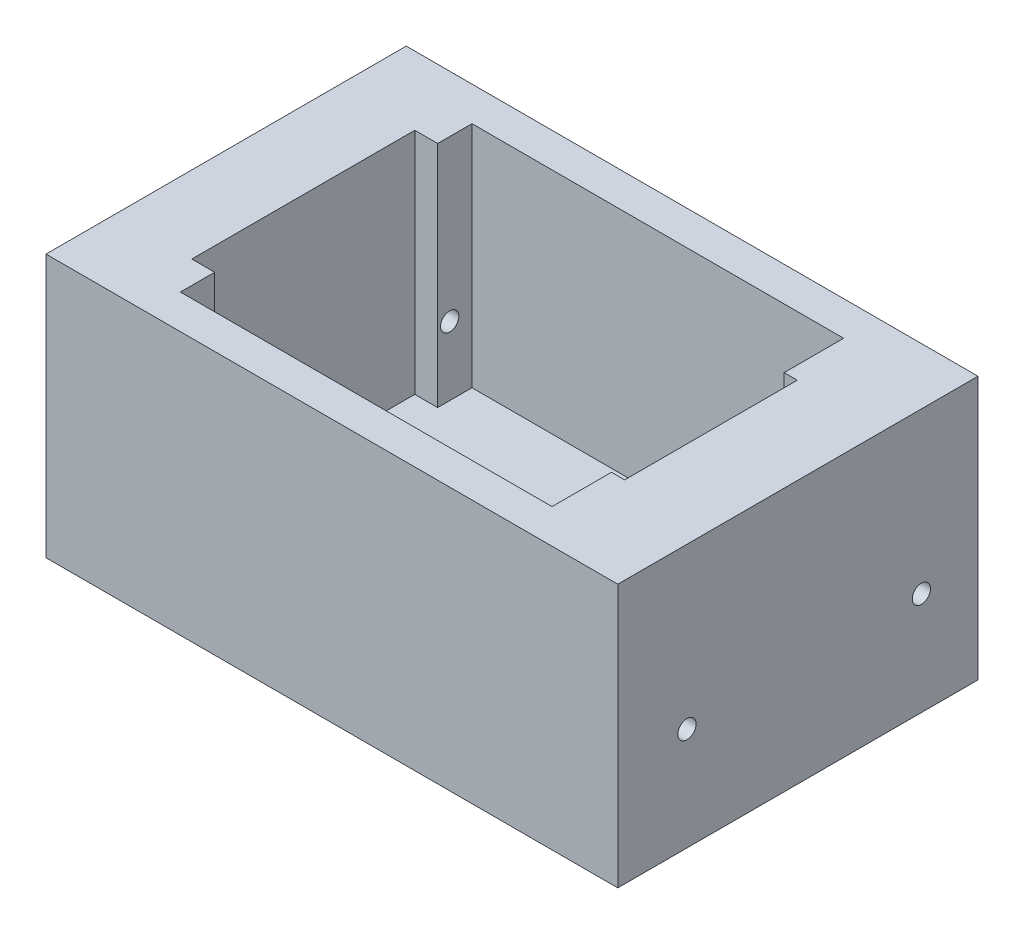
from build123d import *

# Parameters (mm, degrees)
SKETCH1_W               = 50
SKETCH1_H               = 31.5
BOSS_EXTRUDE1_DEPTH     = 23
CUT_EXTRUDE1_DEPTH      = 20
CUT_EXTRUDE2_DEPTH      = 57.769820327
CUT_EXTRUDE2_DEPTH_BACK = 57.769820327
SKETCH3_R               = 0.8


with BuildPart() as part:
    # Sketch1 → Boss-Extrude1 (new body)
    with BuildSketch(Plane(origin=(0, 0, 0), x_dir=(1, 0, 0), z_dir=(0, 1, 0))):
        with Locations((25, 15.75)):
            Rectangle(SKETCH1_W, SKETCH1_H)
    extrude(amount=BOSS_EXTRUDE1_DEPTH)

    # Sketch2 → Cut-Extrude1 (cut)
    with BuildSketch(Plane(origin=(0, 23, 0), x_dir=(1, 0, 0), z_dir=(0, 1, 0))):
        Polygon((41.25, 28.5), (8.75, 28.5), (8.75, 25.5), (6.75, 25.5), (6.75, 6), (8.75, 6), (8.75, 3), (41.25, 3), (41.25, 8.2), (42.4, 8.2), (42.4, 23.3), (41.25, 23.3), align=None)
    extrude(amount=-CUT_EXTRUDE1_DEPTH, mode=Mode.SUBTRACT)

    # Sketch3 → Cut-Extrude2 (cut, two sides: drawn at the far end of the back side and taken through both)
    with BuildSketch(Plane.ZY.offset(-41.25).offset(-CUT_EXTRUDE2_DEPTH_BACK)):
        with Locations(Location((-26.55, 9, 0), (0, 0, 180))):
            Circle(SKETCH3_R)
        with Locations(Location((-6.05, 9, 0), (0, 0, 273.583321698))):
            Circle(SKETCH3_R)
    extrude(amount=CUT_EXTRUDE2_DEPTH + CUT_EXTRUDE2_DEPTH_BACK, mode=Mode.SUBTRACT)


solid = part.part
